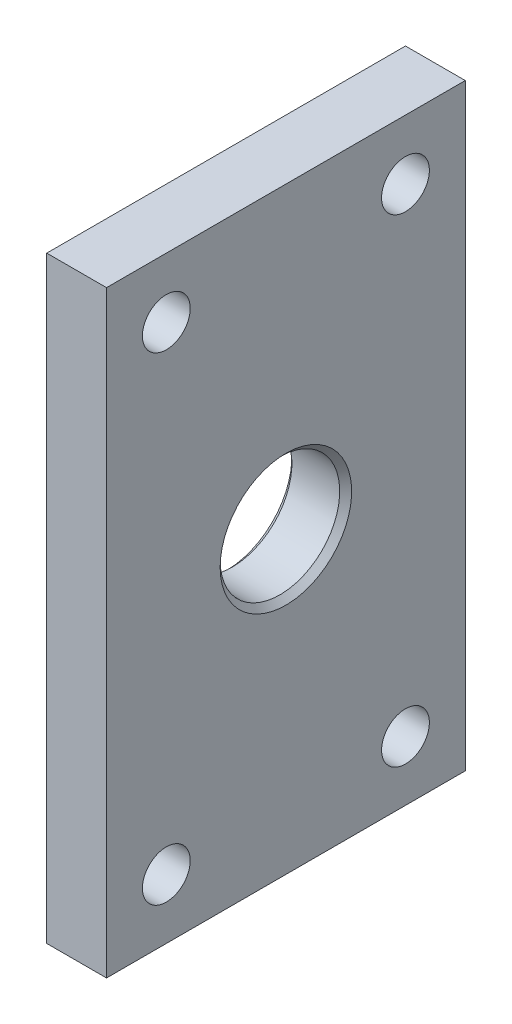
from build123d import *

# Parameters (mm, degrees)
SKETCH1_W           = 100
SKETCH1_H           = 60
BOSS_EXTRUDE1_DEPTH = 10
SKETCH2_R           = 4
CUT_EXTRUDE2_DEPTH  = 118.046999107
SKETCH3_R           = 10
CUT_EXTRUDE4_DEPTH  = 118.046999107
CHAMFER1_SIZE       = 1


with BuildPart() as part:
    # Sketch1 → Boss-Extrude1 (new body)
    with BuildSketch(Plane.YZ):
        with Locations((50, 30)):
            Rectangle(SKETCH1_W, SKETCH1_H)
    extrude(amount=BOSS_EXTRUDE1_DEPTH)

    # Sketch2 → Cut-Extrude2 (cut, through all)
    with BuildSketch(Plane.YZ):
        with Locations(Location((10, 10, 0), (0, 0, 270))):
            Circle(SKETCH2_R)
        with Locations(Location((90, 10, 0), (0, 0, 270))):
            Circle(SKETCH2_R)
        with Locations(Location((10, 50, 0), (0, 0, 270))):
            Circle(SKETCH2_R)
        with Locations(Location((90, 50, 0), (0, 0, 270))):
            Circle(SKETCH2_R)
    extrude(amount=CUT_EXTRUDE2_DEPTH, mode=Mode.SUBTRACT)

    # Sketch3 → Cut-Extrude4 (cut, through all)
    with BuildSketch(Plane.YZ):
        with Locations(Location((50, 30, 0), (0, 0, 270))):
            Circle(SKETCH3_R)
    extrude(amount=CUT_EXTRUDE4_DEPTH, mode=Mode.SUBTRACT)

    # Chamfer1
    chamfer1_edges = [part.edges().sort_by_distance(p)[0] for p in [
        (0, 50, 40),
        (10, 50, 40),
    ]]
    chamfer(chamfer1_edges, length=CHAMFER1_SIZE)


solid = part.part
